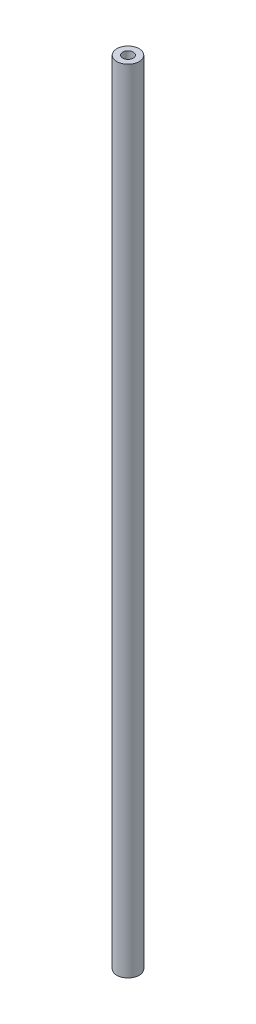
from build123d import *

# Parameters (mm, degrees)
CROQUIS2_R              = 6.35
SALIENTE_EXTRUIR1_DEPTH = 450
CROQUIS3_R              = 3
CORTAR_EXTRUIR1_DEPTH   = 24
CORTAR_EXTRUIR2_START   = -24
CROQUIS4_R              = 3
CORTAR_EXTRUIR2_DEPTH   = 24


with BuildPart() as part:
    # Croquis2 → Saliente-Extruir1 (new body)
    with BuildSketch(Plane(origin=(0, 0, 0), x_dir=(1, 0, 0), z_dir=(0, 1, 0))):
        with Locations(Location((0, 0, 0), (0, 0, 270))):
            Circle(CROQUIS2_R)
    extrude(amount=SALIENTE_EXTRUIR1_DEPTH)

    # Croquis3 → Cortar-Extruir1 (cut)
    with BuildSketch(Plane(origin=(0, 450, 0), x_dir=(1, 0, 0), z_dir=(0, 1, 0))):
        with Locations(Location((0, 0, 0), (0, 0, 270))):
            Circle(CROQUIS3_R)
    extrude(amount=-CORTAR_EXTRUIR1_DEPTH, mode=Mode.SUBTRACT)

    # Croquis4 → Cortar-Extruir2 (cut)
    with BuildSketch(Plane(origin=(0, 0, 0), x_dir=(-1, 0, 0), z_dir=(0, -1, 0)).offset(CORTAR_EXTRUIR2_START)):
        with Locations(Location((0, 0, 0), (0, 0, 270))):
            Circle(CROQUIS4_R)
    extrude(amount=CORTAR_EXTRUIR2_DEPTH, mode=Mode.SUBTRACT)


solid = part.part
